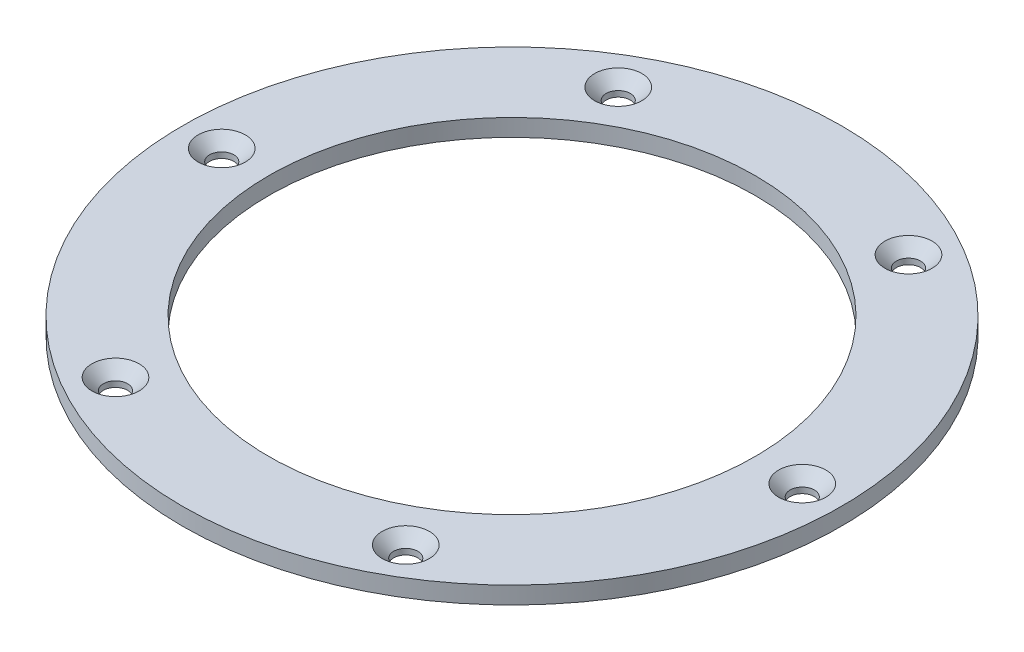
from build123d import *

# Parameters (mm, degrees)
SKETCH_1_W          = 15
SKETCH_1_H          = 3
SKETCH_2_R          = 2.1
CUT_EXTRUDE_1_DEPTH = 10
CHAMFER_1_SIZE      = 2


with BuildPart() as part:
    # 草图1 → 旋转1 (revolve)
    with BuildSketch(Plane.XY, mode=Mode.PRIVATE) as revolve_1_sk:
        with Locations((49.78, 4.365902373)):
            Rectangle(SKETCH_1_W, SKETCH_1_H)
    revolve(revolve_1_sk.sketch.rotate(Axis((0, 0, 0), (0, 1, 0)), 90), axis=Axis((0, 0, 0), (0, 1, 0)))

    # 草图2 → 切除-拉伸1 (cut)
    with BuildSketch(Plane(origin=(0, 5.865902373, 0), x_dir=(1, 0, 0), z_dir=(0, 1, 0))):
        with Locations(Location((-50.45, 0, 0), (0, 0, 270))):
            Circle(SKETCH_2_R)
        with Locations(Location((-25.225, 43.690981621, 0), (0, 0, 270))):
            Circle(SKETCH_2_R)
        with Locations(Location((25.225, 43.690981621, 0), (0, 0, 270))):
            Circle(SKETCH_2_R)
        with Locations(Location((50.45, 0, 0), (0, 0, 270))):
            Circle(SKETCH_2_R)
        with Locations(Location((25.225, -43.690981621, 0), (0, 0, 270))):
            Circle(SKETCH_2_R)
        with Locations(Location((-25.225, -43.690981621, 0), (0, 0, 270))):
            Circle(SKETCH_2_R)
    extrude(amount=-CUT_EXTRUDE_1_DEPTH, mode=Mode.SUBTRACT)

    # 倒角1
    chamfer_1_edges = [part.edges().sort_by_distance(p)[0] for p in [
        (-50.45, 5.865902373, -2.1),
        (-25.225, 5.865902373, 41.590981621),
        (25.225, 5.865902373, 41.590981621),
        (50.45, 5.865902373, -2.1),
        (25.225, 5.865902373, -45.790981621),
        (-25.225, 5.865902373, -45.790981621),
    ]]
    chamfer(chamfer_1_edges, length=CHAMFER_1_SIZE)


solid = part.part
